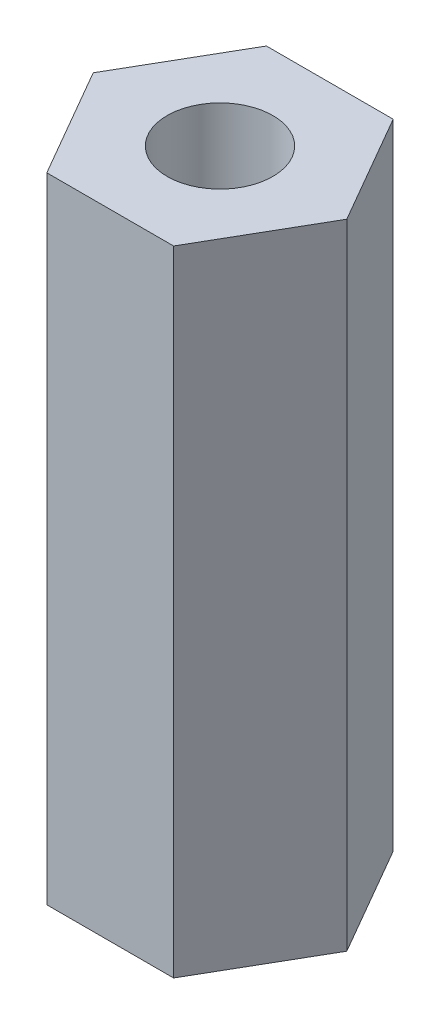
from build123d import *

# Parameters (mm, degrees)
EXTRUDE_1_DEPTH    = 15
HOLE_WIZARD_M3_1_D = 2.5


with BuildPart() as part:
    # 草图1 → 凸台-拉伸1 (new body)
    with BuildSketch(Plane(origin=(0, 0, 0), x_dir=(1, 0, 0), z_dir=(0, 1, 0))):
        Polygon((1.5, 2.598076211), (-1.5, 2.598076211), (-3, 0), (-1.5, -2.598076211), (1.5, -2.598076211), (3, 0), align=None)
    extrude(amount=EXTRUDE_1_DEPTH)

    # M3 螺纹孔1 (through all)
    with Locations(Plane(origin=(0, 15, 0), x_dir=(1, 0, 0), z_dir=(0, 1, 0))):
        with Locations((0, 0)):
            Hole(HOLE_WIZARD_M3_1_D / 2)


solid = part.part
